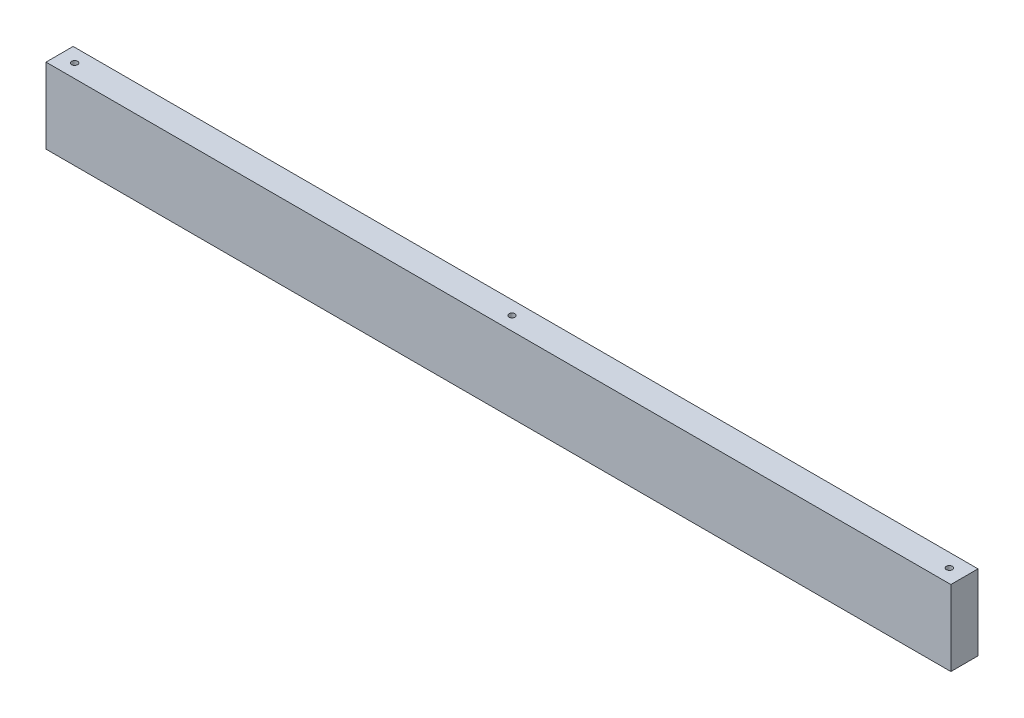
from build123d import *

# Parameters (mm, degrees)
SKETCH1_W           = 600
SKETCH1_H           = 50
BOSS_EXTRUDE1_DEPTH = 18
SKETCH2_R           = 2
CUT_EXTRUDE1_DEPTH  = 25


with BuildPart() as part:
    # Sketch1 → Boss-Extrude1 (new body)
    with BuildSketch(Plane.XY):
        Rectangle(SKETCH1_W, SKETCH1_H)
    extrude(amount=BOSS_EXTRUDE1_DEPTH)

    # Sketch2 → Cut-Extrude1 (cut)
    with BuildSketch(Plane(origin=(0, 25, 0), x_dir=(1, 0, 0), z_dir=(0, 1, 0))):
        with Locations(Location((-290, -9, 0), (0, 0, 270))):
            Circle(SKETCH2_R)
        with Locations(Location((0, -9, 0), (0, 0, 270))):
            Circle(SKETCH2_R)
        with Locations(Location((290, -9, 0), (0, 0, 270))):
            Circle(SKETCH2_R)
    extrude(amount=-CUT_EXTRUDE1_DEPTH, mode=Mode.SUBTRACT)


solid = part.part
